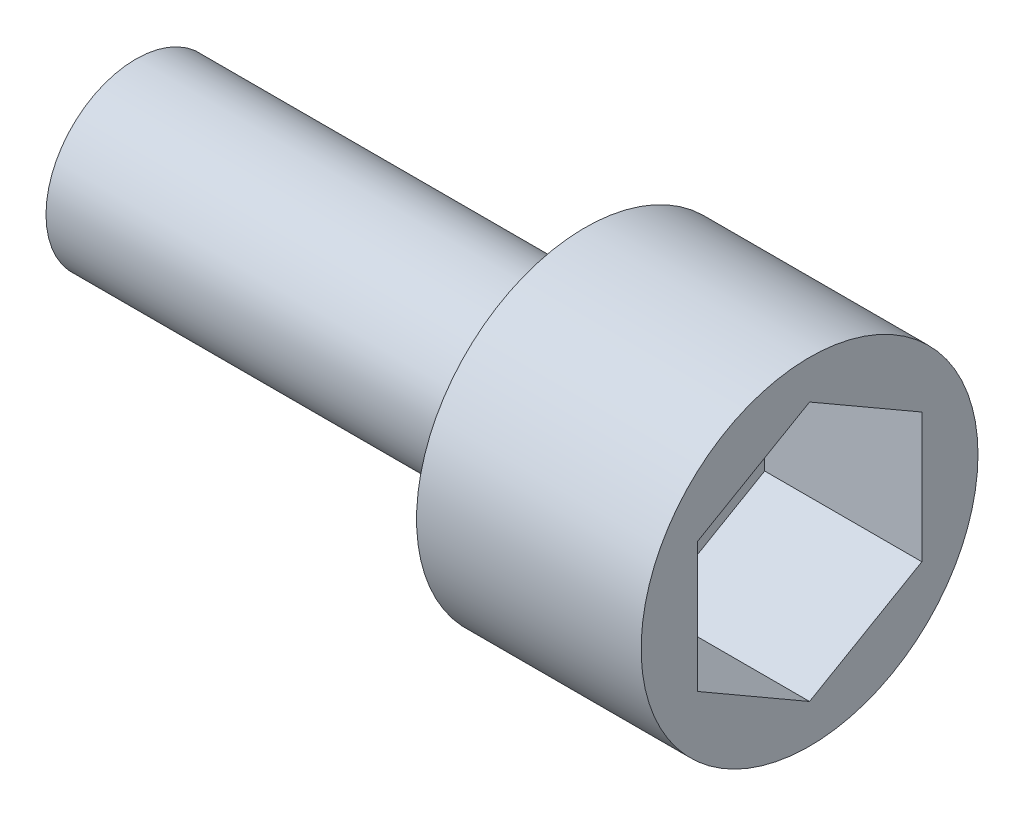
from build123d import *

# Parameters (mm, degrees)
SKETCH1_R           = 7.5
BOSS_EXTRUDE1_DEPTH = 10
CUT_EXTRUDE1_DEPTH  = 7
SKETCH3_R           = 4
BOSS_EXTRUDE2_DEPTH = 20


with BuildPart() as part:
    # Sketch1 → Boss-Extrude1 (new body)
    with BuildSketch(Plane.YZ):
        with Locations(Location((0, 0, 0), (0, 0, 270))):
            Circle(SKETCH1_R)
    extrude(amount=BOSS_EXTRUDE1_DEPTH)

    # Sketch2 → Cut-Extrude1 (cut)
    with BuildSketch(Plane.YZ.offset(10)):
        Polygon((5.773502692, 0), (2.886751346, 5), (-2.886751346, 5), (-5.773502692, 0), (-2.886751346, -5), (2.886751346, -5), align=None)
    extrude(amount=-CUT_EXTRUDE1_DEPTH, mode=Mode.SUBTRACT)

    # Sketch3 → Boss-Extrude2 (add)
    with BuildSketch(Plane(origin=(0, 0, 0), x_dir=(0, -1, 0), z_dir=(-1, 0, 0))):
        with Locations(Location((0, 0, 0), (0, 0, 90))):
            Circle(SKETCH3_R)
    extrude(amount=BOSS_EXTRUDE2_DEPTH)


solid = part.part
